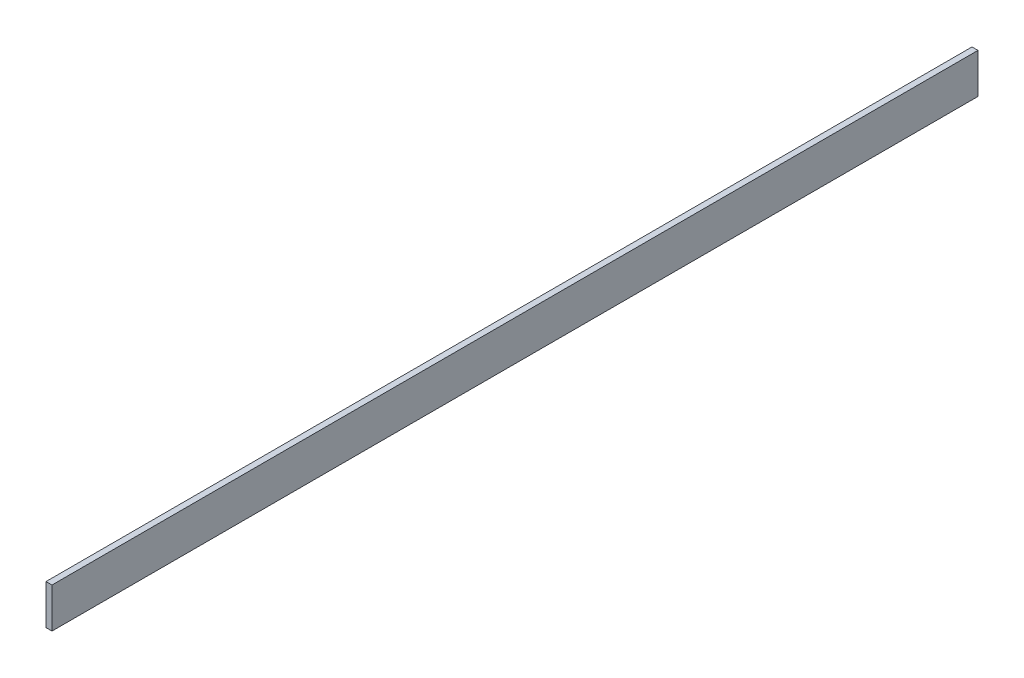
from build123d import *

# Parameters (mm, degrees)
ESQUISSE1_W        = 3
ESQUISSE1_H        = 20
BOSS_EXTRU_1_DEPTH = 464


with BuildPart() as part:
    # Esquisse1 → Boss.-Extru.1 (new body)
    with BuildSketch(Plane.XY):
        with Locations((1.5, 10)):
            Rectangle(ESQUISSE1_W, ESQUISSE1_H)
    extrude(amount=BOSS_EXTRU_1_DEPTH)


solid = part.part
